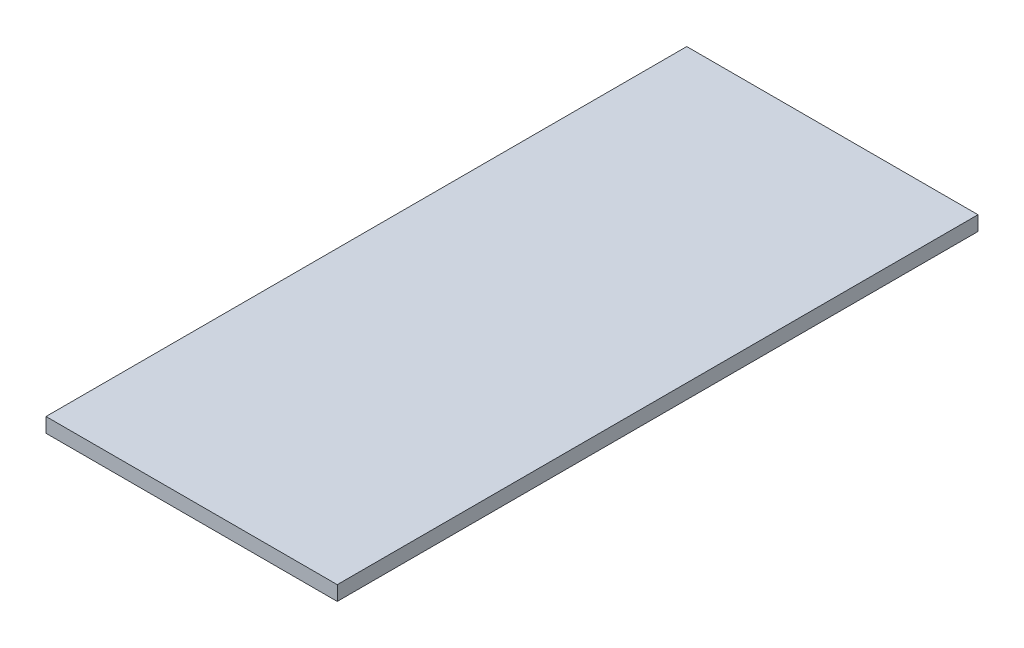
from build123d import *

# Parameters (mm, degrees)
SKETCH1_W           = 254
SKETCH1_H           = 558.8
BOSS_EXTRUDE1_DEPTH = 12.7


with BuildPart() as part:
    # Sketch1 → Boss-Extrude1 (new body)
    with BuildSketch(Plane(origin=(0, 0, 0), x_dir=(1, 0, 0), z_dir=(0, 1, 0))):
        Rectangle(SKETCH1_W, SKETCH1_H)
    extrude(amount=BOSS_EXTRUDE1_DEPTH)


solid = part.part
